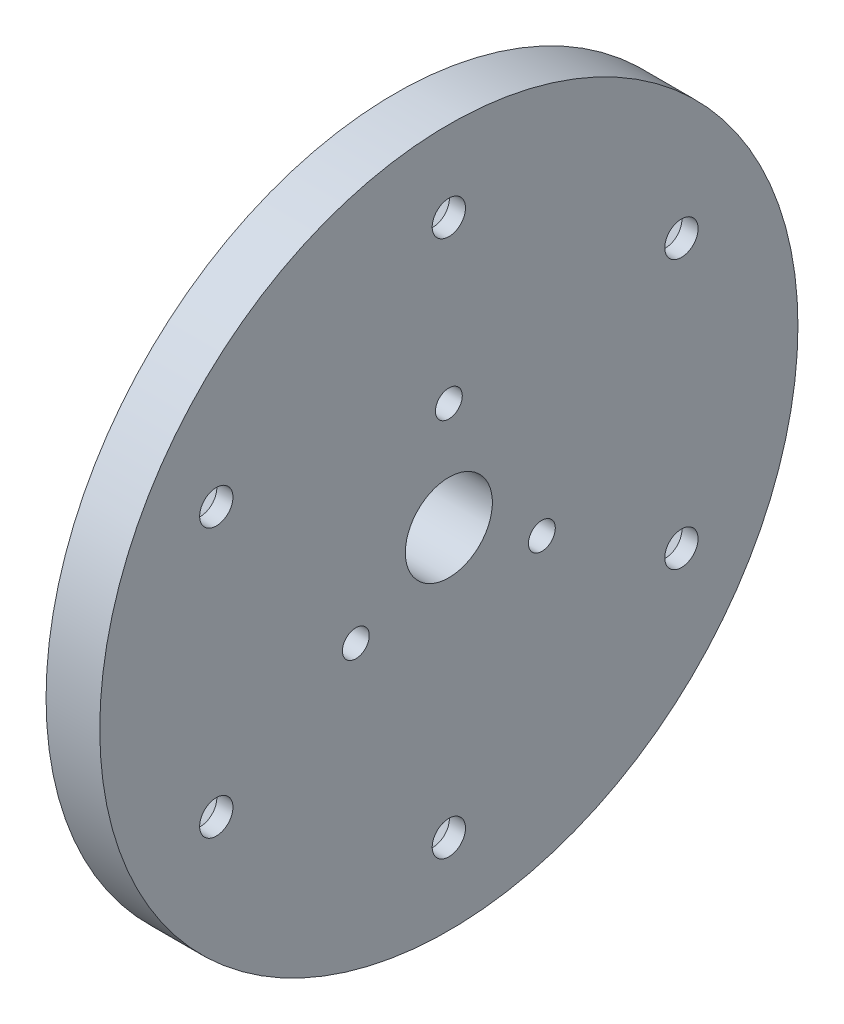
from build123d import *

# Parameters (mm, degrees)
F_8_1_8_1_DURCHMESSER_BOHRUNG1_D = 8.1
SKIZZE4_R                        = 1.25
SCHNITT_LINEAR_AUSTRAGEN1_DEPTH  = 47.652974182
SKIZZE5_R                        = 1.55
SCHNITT_LINEAR_AUSTRAGEN2_DEPTH  = 47.652974182
FASE2_SIZE                       = 3.5


with BuildPart() as part:
    # Skizze1 → Rotation1 (revolve)
    with BuildSketch(Plane.XY, mode=Mode.PRIVATE) as rotation1_sk:
        Polygon((0, 0), (0, 16.5), (3, 16.5), (3, 32.5), (8, 32.5), (8, 0), align=None)
    revolve(rotation1_sk.sketch.rotate(Axis((0, 0, 0), (-1, 0, 0)), 90), axis=Axis((0, 0, 0), (-1, 0, 0)))

    # Ø8.1 (8.1) Durchmesser Bohrung1 (through all)
    with Locations(Plane.ZY):
        with Locations((0, 0)):
            Hole(F_8_1_8_1_DURCHMESSER_BOHRUNG1_D / 2)

    # Skizze4 → Schnitt-Linear austragen1 (cut, through all)
    with BuildSketch(Plane(origin=(8, 0, 0), x_dir=(0, 0, -1), z_dir=(1, 0, 0))):
        with Locations((0, 10)):
            Circle(SKIZZE4_R)
        with Locations((8.660254038, -5)):
            Circle(SKIZZE4_R)
        with Locations((-8.660254038, -5)):
            Circle(SKIZZE4_R)
    extrude(amount=-SCHNITT_LINEAR_AUSTRAGEN1_DEPTH, mode=Mode.SUBTRACT)

    # Skizze5 → Schnitt-Linear austragen2 (cut, through all)
    with BuildSketch(Plane(origin=(8, 0, 0), x_dir=(0, 0, -1), z_dir=(1, 0, 0))):
        with Locations((0, 25)):
            Circle(SKIZZE5_R)
        with Locations((21.650635095, 12.5)):
            Circle(SKIZZE5_R)
        with Locations((21.650635095, -12.5)):
            Circle(SKIZZE5_R)
        with Locations((0, -25)):
            Circle(SKIZZE5_R)
        with Locations((-21.650635095, -12.5)):
            Circle(SKIZZE5_R)
        with Locations((-21.650635095, 12.5)):
            Circle(SKIZZE5_R)
    extrude(amount=-SCHNITT_LINEAR_AUSTRAGEN2_DEPTH, mode=Mode.SUBTRACT)

    # Fase2
    fase2_edges = [part.edges().sort_by_distance(p)[0] for p in [
        (3, 25, 1.55),
        (3, 12.5, 23.200635095),
        (3, -12.5, 23.200635095),
        (3, -25, 1.55),
        (3, -12.5, -20.100635095),
        (3, 12.5, -20.100635095),
    ]]
    chamfer(fase2_edges, length=FASE2_SIZE)


solid = part.part
